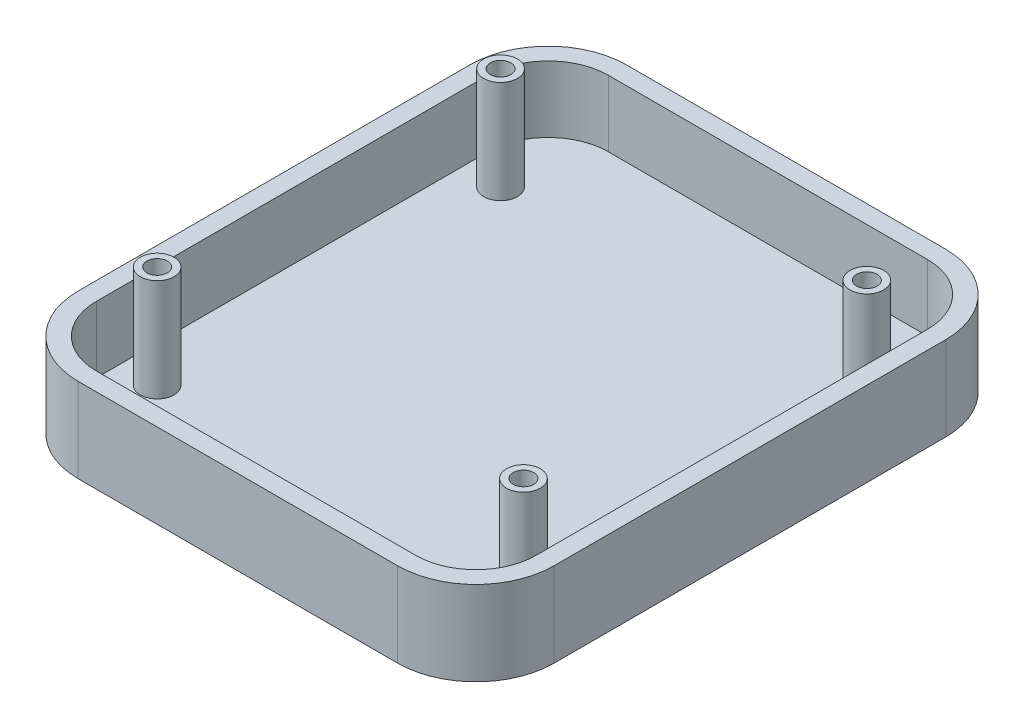
from build123d import *

# Parameters (mm, degrees)
SKETCH_1_W           = 36.5
SKETCH_1_H           = 42.5
EXTRUDE_1_DEPTH      = 1.5
FILLET_1_R           = 5
SKETCH_2_R           = 1.4
SKETCH_2_R_2         = 0.85
EXTRUDE_2_DEPTH      = 8.5
EXTRUDE_3_DEPTH      = 5.5
EXTRUDE_3_DEPTH_BACK = 1.5


with BuildPart() as part:
    # 草图1 → 凸台-拉伸1 (new body)
    with BuildSketch(Plane(origin=(0, 0, 0), x_dir=(1, 0, 0), z_dir=(0, 1, 0))):
        Rectangle(SKETCH_1_W, SKETCH_1_H)
    extrude(amount=EXTRUDE_1_DEPTH)

    # 圆角1
    fillet_1_edges = [part.edges().sort_by_distance(p)[0] for p in [
        (18.25, 0.75, 21.25),
        (-18.25, 0.75, 21.25),
        (-18.25, 0.75, -21.25),
        (18.25, 0.75, -21.25),
    ]]
    fillet(fillet_1_edges, radius=FILLET_1_R)

    # 草图2 → 凸台-拉伸2 (add)
    # profile 1 of 4: a face of its own
    with BuildSketch(Plane(origin=(0, 1.5, 0), x_dir=(1, 0, 0), z_dir=(0, 1, 0))):
        with Locations(Location((-15.2, 14.25, 0), (0, 0, 270))):
            Circle(SKETCH_2_R)
        with Locations(Location((-15.2, 14.25, 0), (0, 0, 270))):
            Circle(SKETCH_2_R_2, mode=Mode.SUBTRACT)
    # profile 2 of 4: a face of its own
    with BuildSketch(Plane(origin=(0, 1.5, 0), x_dir=(1, 0, 0), z_dir=(0, 1, 0))):
        with Locations(Location((-15.2, -14.25, 0), (0, 0, 90))):
            Circle(SKETCH_2_R)
        with Locations(Location((-15.2, -14.25, 0), (0, 0, 90))):
            Circle(SKETCH_2_R_2, mode=Mode.SUBTRACT)
    # profile 3 of 4: a face of its own
    with BuildSketch(Plane(origin=(0, 1.5, 0), x_dir=(1, 0, 0), z_dir=(0, 1, 0))):
        with Locations(Location((15.2, -14.25, 0), (0, 0, 270))):
            Circle(SKETCH_2_R)
        with Locations(Location((15.2, -14.25, 0), (0, 0, 270))):
            Circle(SKETCH_2_R_2, mode=Mode.SUBTRACT)
    # profile 4 of 4: a face of its own
    with BuildSketch(Plane(origin=(0, 1.5, 0), x_dir=(1, 0, 0), z_dir=(0, 1, 0))):
        with Locations(Location((15.2, 14.25, 0), (0, 0, 90))):
            Circle(SKETCH_2_R)
        with Locations(Location((15.2, 14.25, 0), (0, 0, 90))):
            Circle(SKETCH_2_R_2, mode=Mode.SUBTRACT)
    extrude(amount=EXTRUDE_2_DEPTH)

    # 草图3 → 凸台-拉伸3 (add, two sides: drawn at the far end of the back side and taken through both)
    with BuildSketch(Plane(origin=(0, 1.5, 0), x_dir=(1, 0, 0), z_dir=(0, 1, 0)).offset(-EXTRUDE_3_DEPTH_BACK)):
        with BuildLine():
            Line((-13.25, -22.75), (13.25, -22.75))
            ThreePointArc((13.25, -22.75), (17.846194078, -20.846194078), (19.75, -16.25))
            Line((19.75, -16.25), (19.75, 16.25))
            ThreePointArc((19.75, 16.25), (17.846194078, 20.846194078), (13.25, 22.75))
            Line((13.25, 22.75), (-13.25, 22.75))
            ThreePointArc((-13.25, 22.75), (-17.846194078, 20.846194078), (-19.75, 16.25))
            Line((-19.75, 16.25), (-19.75, -16.25))
            ThreePointArc((-19.75, -16.25), (-17.846194078, -20.846194078), (-13.25, -22.75))
        make_face()
        with BuildLine():
            Line((-13.25, -21.25), (13.25, -21.25))
            ThreePointArc((13.25, -21.25), (16.785533906, -19.785533906), (18.25, -16.25))
            Line((18.25, -16.25), (18.25, 16.25))
            ThreePointArc((18.25, 16.25), (16.785533906, 19.785533906), (13.25, 21.25))
            Line((13.25, 21.25), (-13.25, 21.25))
            ThreePointArc((-13.25, 21.25), (-16.785533906, 19.785533906), (-18.25, 16.25))
            Line((-18.25, 16.25), (-18.25, -16.25))
            ThreePointArc((-18.25, -16.25), (-16.785533906, -19.785533906), (-13.25, -21.25))
        make_face(mode=Mode.SUBTRACT)
    extrude(amount=EXTRUDE_3_DEPTH + EXTRUDE_3_DEPTH_BACK)


solid = part.part
